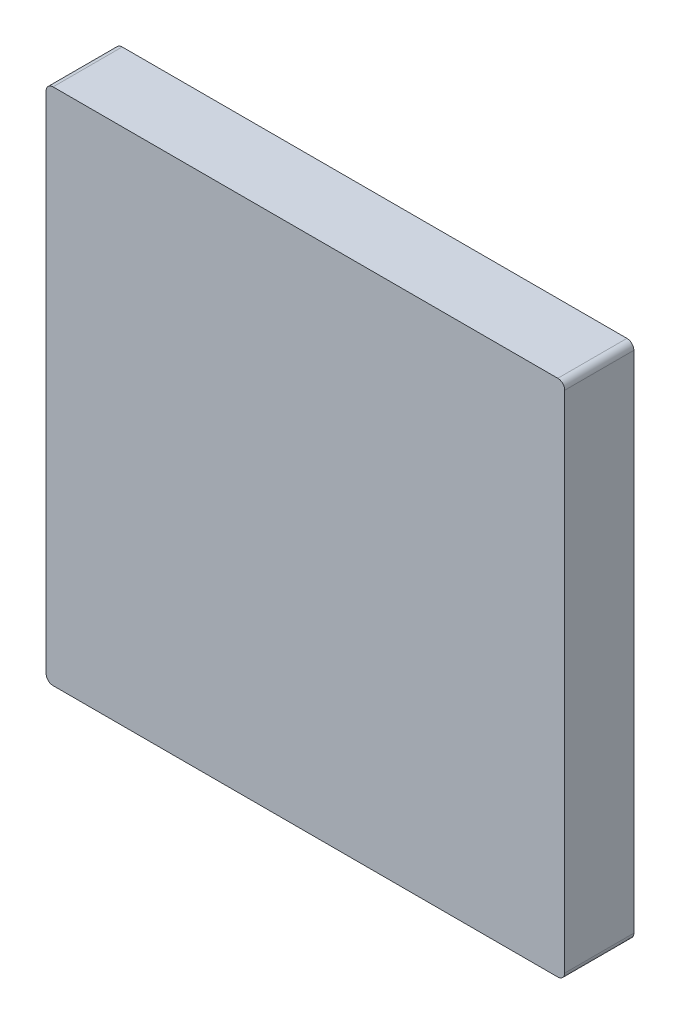
from build123d import *

# Parameters (mm, degrees)
SKETCH2_W           = 150
SKETCH2_H           = 150
BOSS_EXTRUDE1_DEPTH = 20
FILLET1_R           = 2


with BuildPart() as part:
    # Sketch2 → Boss-Extrude1 (new body)
    with BuildSketch(Plane.XY):
        Rectangle(SKETCH2_W, SKETCH2_H)
    extrude(amount=BOSS_EXTRUDE1_DEPTH)

    # Fillet1
    fillet1_edges = [part.edges().sort_by_distance(p)[0] for p in [
        (75, -75, 10),
        (-75, -75, 10),
        (-75, 75, 10),
        (75, 75, 10),
    ]]
    fillet(fillet1_edges, radius=FILLET1_R)


solid = part.part
